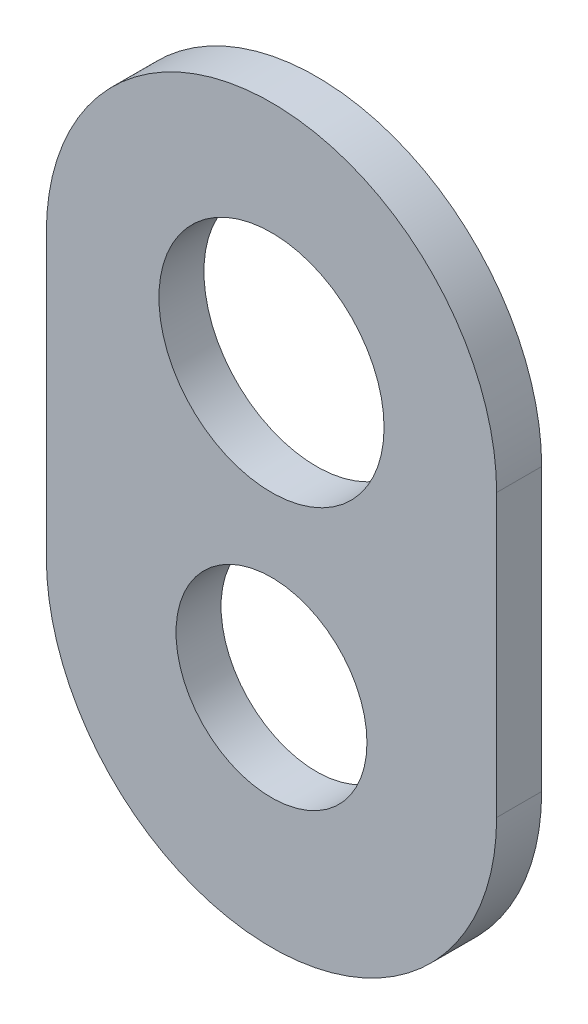
from build123d import *

# Parameters (mm, degrees)
SKETCH1_R           = 12.7
SKETCH1_R_2         = 10.7696
BOSS_EXTRUDE1_DEPTH = 5.08


with BuildPart() as part:
    # Sketch1 → Boss-Extrude1 (new body)
    with BuildSketch(Plane.XY):
        with BuildLine():
            Line((-25.4, 0), (-25.4, -31.75))
            ThreePointArc((-25.4, -31.75), (0, -57.15), (25.4, -31.75))
            Line((25.4, -31.75), (25.4, 0))
            ThreePointArc((25.4, 0), (0, 25.4), (-25.4, 0))
        make_face()
        Circle(SKETCH1_R, mode=Mode.SUBTRACT)
        with Locations((0, -31.75)):
            Circle(SKETCH1_R_2, mode=Mode.SUBTRACT)
    extrude(amount=BOSS_EXTRUDE1_DEPTH)


solid = part.part
